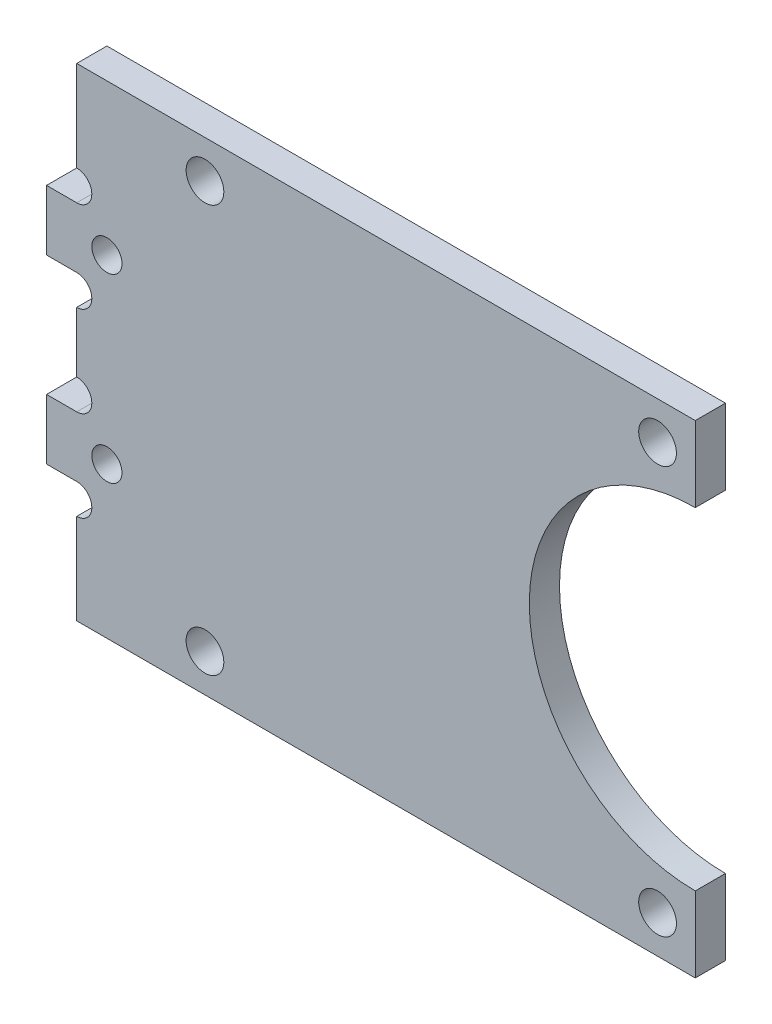
from build123d import *

# Parameters (mm, degrees)
SKETCH_1_R          = 1.25
SKETCH_1_R_2        = 1
EXTRUDE_1_DEPTH     = 2
CUT_EXTRUDE_1_DEPTH = 2


with BuildPart() as part:
    # 草圖1 → 填料-伸長1 (new body)
    with BuildSketch(Plane.XY):
        with BuildLine():
            Line((-17.216213198, 10.1625), (15.283786802, 10.1625))
            Line((15.283786802, 10.1625), (15.283786802, -21.8375))
            Line((15.283786802, -21.8375), (-17.216213198, -21.8375))
            Line((-17.216213198, -21.8375), (-19.716213198, -21.8375))
            Line((-19.716213198, -21.8375), (-25.716213198, -21.8375))
            Line((-25.716213198, -21.8375), (-25.716213198, -15.8375))
            ThreePointArc((-25.716213198, -15.8375), (-24.716213198, -14.8375), (-25.716213198, -13.8375))
            Line((-25.716213198, -13.8375), (-27.716213198, -13.8375))
            Line((-27.716213198, -13.8375), (-27.716213198, -9.8375))
            Line((-27.716213198, -9.8375), (-25.716213198, -9.8375))
            ThreePointArc((-25.716213198, -9.8375), (-24.716213198, -8.8375), (-25.716213198, -7.8375))
            Line((-25.716213198, -7.8375), (-25.716213198, -3.8375))
            ThreePointArc((-25.716213198, -3.8375), (-24.716213198, -2.8375), (-25.716213198, -1.8375))
            Line((-25.716213198, -1.8375), (-27.716213198, -1.8375))
            Line((-27.716213198, -1.8375), (-27.716213198, 2.1625))
            Line((-27.716213198, 2.1625), (-25.716213198, 2.1625))
            ThreePointArc((-25.716213198, 2.1625), (-24.716213198, 3.1625), (-25.716213198, 4.1625))
            Line((-25.716213198, 4.1625), (-25.716213198, 10.1625))
            Line((-25.716213198, 10.1625), (-19.716213198, 10.1625))
            Line((-19.716213198, 10.1625), (-17.216213198, 10.1625))
        make_face()
        with Locations((-17.216213198, 7.6625)):
            Circle(SKETCH_1_R, mode=Mode.SUBTRACT)
        with Locations((-17.216213198, -19.3375)):
            Circle(SKETCH_1_R, mode=Mode.SUBTRACT)
        with Locations((12.783786802, -19.3375)):
            Circle(SKETCH_1_R, mode=Mode.SUBTRACT)
        with Locations((12.783786802, 7.6625)):
            Circle(SKETCH_1_R, mode=Mode.SUBTRACT)
        with Locations((-23.716213198, -11.8375)):
            Circle(SKETCH_1_R_2, mode=Mode.SUBTRACT)
        with Locations((-23.716213198, 0.1625)):
            Circle(SKETCH_1_R_2, mode=Mode.SUBTRACT)
    extrude(amount=EXTRUDE_1_DEPTH)

    # 草圖4 → 除料-伸長1 (cut)
    with BuildSketch(Plane(origin=(0, 0, 0), x_dir=(-1, 0, 0), z_dir=(0, 0, -1))):
        with BuildLine():
            Line((-15.283786802, -16.8375), (-15.283786802, 5.1625))
            ThreePointArc((-15.283786802, 5.1625), (-4.283786802, -5.8375), (-15.283786802, -16.8375))
        make_face()
    extrude(amount=-CUT_EXTRUDE_1_DEPTH, mode=Mode.SUBTRACT)


solid = part.part
